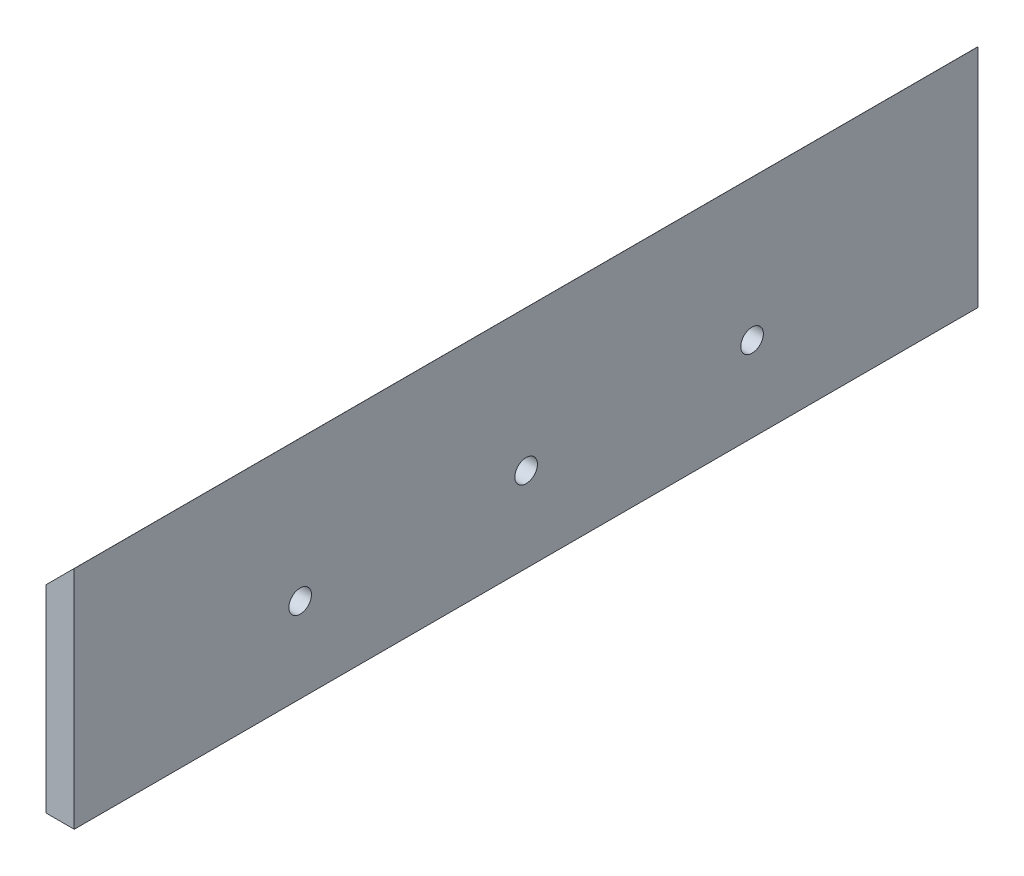
from build123d import *

# Parameters (mm, degrees)
EXTRUDE_1_DEPTH    = 160
CHAMFER1_SIZE      = 5
CHAMFER1_SIZE2     = 4.986026333
SKETCH1_R          = 2
CUT_EXTRUDE1_DEPTH = 5
LPATTERN1_COUNT    = 3
LPATTERN1_PITCH    = 40


with BuildPart() as part:
    # 草圖1 → 填料-伸長1 (new body)
    with BuildSketch(Plane.XY):
        Polygon((203.623972775, 1001.176903993), (198.623972775, 1001.176903993), (198.623972775, 1041.176903993), (203.623972775, 1041.162871417), align=None)
    extrude(amount=EXTRUDE_1_DEPTH)

    # Chamfer1
    chamfer1_edges = [part.edges().sort_by_distance(p)[0] for p in [
        (198.623972775, 1041.176903993, 80),
    ]]
    chamfer1_side = [part.faces().sort_by_distance(p)[0] for p in [
        (198.623972775, 1021.176903993, 80),
    ]]
    chamfer(chamfer1_edges, length=CHAMFER1_SIZE, length2=CHAMFER1_SIZE2, reference=chamfer1_side[0])

    # Sketch1 → Cut-Extrude1 (cut)
    with BuildSketch(Plane(origin=(203.623972775, 0, 0), x_dir=(0, 0, -1), z_dir=(1, 0, 0))):
        with Locations((-40, 1016.176903993)):
            Circle(SKETCH1_R)
    cut_extrude1 = extrude(amount=-CUT_EXTRUDE1_DEPTH, mode=Mode.SUBTRACT)

    # LPattern1: Cut-Extrude1 ×3
    with Locations(*[(0, 0, i * LPATTERN1_PITCH) for i in range(1, LPATTERN1_COUNT)]):
        add(cut_extrude1, mode=Mode.SUBTRACT)


solid = part.part
